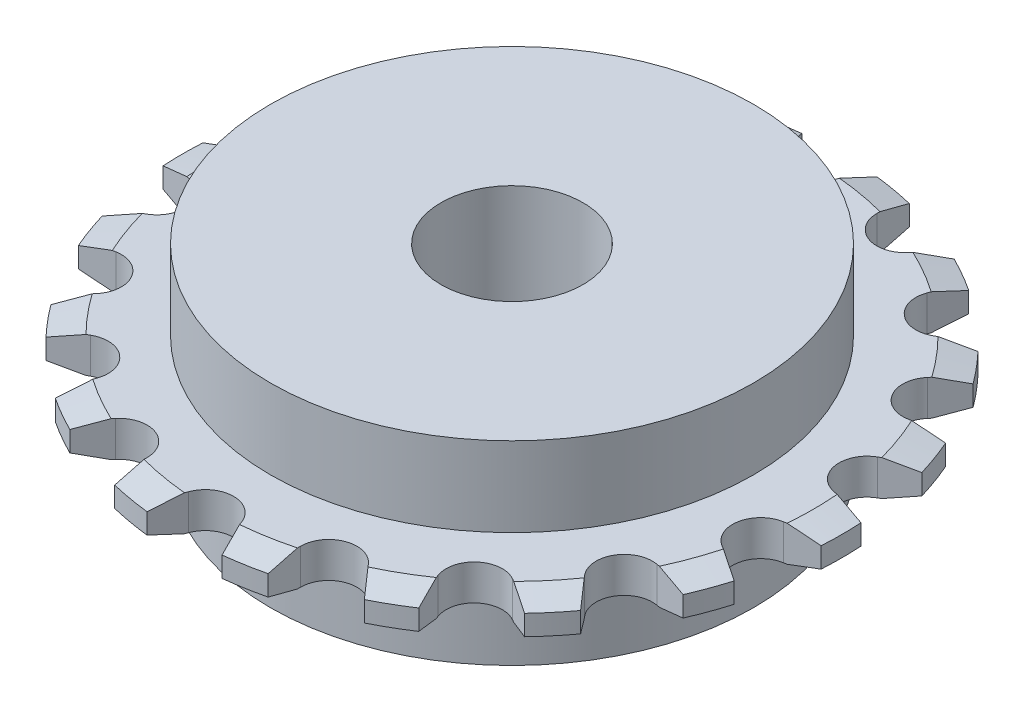
from build123d import *
from OCP.BRepFilletAPI import BRepFilletAPI_MakeChamfer

# Parameters (mm, degrees)
SKETCH1_R                = 29.468618182
SKETCH1_R_2              = 6.35
BOSS_EXTRUDE1_DEPTH      = 3.175
CHAMFER1_SIZE            = 2.54
CHAMFER1_SIZE2           = 0.680590949
CUT_EXTRUDE2_DEPTH       = 42.795688056
BOSS_EXTRUDE2_DEPTH      = 7.112
BOSS_EXTRUDE2_DEPTH_BACK = 10.287
SKETCH4_R                = 21.59
SKETCH4_R_2              = 6.35


with BuildPart() as part:
    # Sketch1 → Boss-Extrude1 (new body)
    with BuildSketch(Plane(origin=(0, 0, 0), x_dir=(1, 0, 0), z_dir=(0, 1, 0))):
        with Locations(Location((0, 0, 0), (0, 0, 270))):
            Circle(SKETCH1_R)
        with Locations(Location((0, 0, 0), (0, 0, 270))):
            Circle(SKETCH1_R_2, mode=Mode.SUBTRACT)
    extrude(amount=BOSS_EXTRUDE1_DEPTH)

    # Chamfer1: one chamfer whose edges measure the first distance from different faces: ONE call of the kernel's chamfer builder (chamfer() names one face for all edges)
    chamfer1_edges_1 = [part.edges().sort_by_distance(p)[0] for p in [
        (0, 0, -29.468618182),
    ]]
    chamfer1_side_1 = [part.faces().sort_by_distance(p)[0] for p in [
        (0, 0, -28.635119792),
    ]]
    chamfer1_edges_2 = [part.edges().sort_by_distance(p)[0] for p in [
        (0, 3.175, -29.468618182),
    ]]
    chamfer1_side_2 = [part.faces().sort_by_distance(p)[0] for p in [
        (0, 3.175, -28.635119792),
    ]]
    chamfer1 = BRepFilletAPI_MakeChamfer(part.part.solid().wrapped)
    for e in chamfer1_edges_1:
        chamfer1.Add(CHAMFER1_SIZE, CHAMFER1_SIZE2, e.wrapped, chamfer1_side_1[0].wrapped)  # the first distance lies on this face
    for e in chamfer1_edges_2:
        chamfer1.Add(CHAMFER1_SIZE, CHAMFER1_SIZE2, e.wrapped, chamfer1_side_2[0].wrapped)  # the first distance lies on this face
    add(Compound.cast(chamfer1.Shape()), mode=Mode.REPLACE)

    # Sketch3 → Cut-Extrude2 (cut, through all)
    with BuildSketch(Plane(origin=(0, 3.175, 0), x_dir=(1, 0, 0), z_dir=(0, 1, 0))):
        with BuildLine():
            Line((2.362951064, 26.551174329), (3.355071849, 29.277003782))
            ThreePointArc((3.355071849, 29.277003782), (0, 29.468618182), (-3.355071849, 29.277003782))
            Line((-3.355071849, 29.277003782), (-2.362951064, 26.551174329))
            ThreePointArc((-2.362951064, 26.551174329), (0, 24.896618182), (2.362951064, 26.551174329))
        make_face()
        with BuildLine():
            Line((6.860588771, 25.758119452), (6.860588771, 28.658886567))
            ThreePointArc((6.860588771, 28.658886567), (10.078861014, 27.69144305), (13.166061288, 26.363882258))
            Line((13.166061288, 26.363882258), (11.301484128, 24.141765729))
            ThreePointArc((11.301484128, 24.141765729), (8.515144919, 23.395168388), (6.860588771, 25.758119452))
        make_face()
        with BuildLine():
            Line((15.256640349, 21.85825522), (16.248761134, 24.584084672))
            ThreePointArc((16.248761134, 24.584084672), (18.942062642, 22.574271205), (21.389029426, 20.270887444))
            Line((21.389029426, 20.270887444), (18.876891414, 18.820503887))
            ThreePointArc((18.876891414, 18.820503887), (16.00323769, 19.071916011), (15.256640349, 21.85825522))
        make_face()
        with BuildLine():
            Line((21.812515937, 15.321962814), (23.677093097, 17.544079343))
            ThreePointArc((23.677093097, 17.544079343), (25.52057196, 14.734309091), (27.032164946, 11.732924438))
            Line((27.032164946, 11.732924438), (24.175467002, 11.229211515))
            ThreePointArc((24.175467002, 11.229211515), (21.561103814, 12.448309091), (21.812515937, 15.321962814))
        make_face()
        with BuildLine():
            Line((25.737480185, 6.937615565), (28.249618197, 8.387999123))
            ThreePointArc((28.249618197, 8.387999123), (29.020923656, 5.117171846), (29.414822422, 1.779797586))
            Line((29.414822422, 1.779797586), (26.558124477, 2.283510509))
            ThreePointArc((26.558124477, 2.283510509), (24.518382609, 4.323252377), (25.737480185, 6.937615565))
        make_face()
        with BuildLine():
            Line((26.558124477, -2.283510509), (29.414822422, -1.779797586))
            ThreePointArc((29.414822422, -1.779797586), (29.020923656, -5.117171846), (28.249618197, -8.387999123))
            Line((28.249618197, -8.387999123), (25.737480185, -6.937615565))
            ThreePointArc((25.737480185, -6.937615565), (24.518382609, -4.323252377), (26.558124477, -2.283510509))
        make_face()
        with BuildLine():
            Line((24.175467002, -11.229211515), (27.032164946, -11.732924438))
            ThreePointArc((27.032164946, -11.732924438), (25.52057196, -14.734309091), (23.677093097, -17.544079343))
            Line((23.677093097, -17.544079343), (21.812515937, -15.321962814))
            ThreePointArc((21.812515937, -15.321962814), (21.561103814, -12.448309091), (24.175467002, -11.229211515))
        make_face()
        with BuildLine():
            Line((18.876891414, -18.820503887), (21.389029426, -20.270887444))
            ThreePointArc((21.389029426, -20.270887444), (18.942062642, -22.574271205), (16.248761134, -24.584084672))
            Line((16.248761134, -24.584084672), (15.256640349, -21.85825522))
            ThreePointArc((15.256640349, -21.85825522), (16.00323769, -19.071916011), (18.876891414, -18.820503887))
        make_face()
        with BuildLine():
            Line((11.301484128, -24.141765729), (13.166061288, -26.363882258))
            ThreePointArc((13.166061288, -26.363882258), (10.078861014, -27.69144305), (6.860588771, -28.658886567))
            Line((6.860588771, -28.658886567), (6.860588771, -25.758119452))
            ThreePointArc((6.860588771, -25.758119452), (8.515144919, -23.395168388), (11.301484128, -24.141765729))
        make_face()
        with BuildLine():
            Line((2.362951064, -26.551174329), (3.355071849, -29.277003782))
            ThreePointArc((3.355071849, -29.277003782), (0, -29.468618182), (-3.355071849, -29.277003782))
            Line((-3.355071849, -29.277003782), (-2.362951064, -26.551174329))
            ThreePointArc((-2.362951064, -26.551174329), (0, -24.896618182), (2.362951064, -26.551174329))
        make_face()
        with BuildLine():
            Line((-6.860588771, -25.758119452), (-6.860588771, -28.658886567))
            ThreePointArc((-6.860588771, -28.658886567), (-10.078861014, -27.69144305), (-13.166061288, -26.363882258))
            Line((-13.166061288, -26.363882258), (-11.301484128, -24.141765729))
            ThreePointArc((-11.301484128, -24.141765729), (-8.515144919, -23.395168388), (-6.860588771, -25.758119452))
        make_face()
        with BuildLine():
            Line((-15.256640349, -21.85825522), (-16.248761134, -24.584084672))
            ThreePointArc((-16.248761134, -24.584084672), (-18.942062642, -22.574271205), (-21.389029426, -20.270887444))
            Line((-21.389029426, -20.270887444), (-18.876891414, -18.820503887))
            ThreePointArc((-18.876891414, -18.820503887), (-16.00323769, -19.071916011), (-15.256640349, -21.85825522))
        make_face()
        with BuildLine():
            Line((-21.812515937, -15.321962814), (-23.677093097, -17.544079343))
            ThreePointArc((-23.677093097, -17.544079343), (-25.52057196, -14.734309091), (-27.032164946, -11.732924438))
            Line((-27.032164946, -11.732924438), (-24.175467002, -11.229211515))
            ThreePointArc((-24.175467002, -11.229211515), (-21.561103814, -12.448309091), (-21.812515937, -15.321962814))
        make_face()
        with BuildLine():
            Line((-25.737480185, -6.937615565), (-28.249618197, -8.387999123))
            ThreePointArc((-28.249618197, -8.387999123), (-29.020923656, -5.117171846), (-29.414822422, -1.779797586))
            Line((-29.414822422, -1.779797586), (-26.558124477, -2.283510509))
            ThreePointArc((-26.558124477, -2.283510509), (-24.518382609, -4.323252377), (-25.737480185, -6.937615565))
        make_face()
        with BuildLine():
            Line((-26.558124477, 2.283510509), (-29.414822422, 1.779797586))
            ThreePointArc((-29.414822422, 1.779797586), (-29.020923656, 5.117171846), (-28.249618197, 8.387999123))
            Line((-28.249618197, 8.387999123), (-25.737480185, 6.937615565))
            ThreePointArc((-25.737480185, 6.937615565), (-24.518382609, 4.323252377), (-26.558124477, 2.283510509))
        make_face()
        with BuildLine():
            Line((-24.175467002, 11.229211515), (-27.032164946, 11.732924438))
            ThreePointArc((-27.032164946, 11.732924438), (-25.52057196, 14.734309091), (-23.677093097, 17.544079343))
            Line((-23.677093097, 17.544079343), (-21.812515937, 15.321962814))
            ThreePointArc((-21.812515937, 15.321962814), (-21.561103814, 12.448309091), (-24.175467002, 11.229211515))
        make_face()
        with BuildLine():
            Line((-18.876891414, 18.820503887), (-21.389029426, 20.270887444))
            ThreePointArc((-21.389029426, 20.270887444), (-18.942062642, 22.574271205), (-16.248761134, 24.584084672))
            Line((-16.248761134, 24.584084672), (-15.256640349, 21.85825522))
            ThreePointArc((-15.256640349, 21.85825522), (-16.00323769, 19.071916011), (-18.876891414, 18.820503887))
        make_face()
        with BuildLine():
            Line((-11.301484128, 24.141765729), (-13.166061288, 26.363882258))
            ThreePointArc((-13.166061288, 26.363882258), (-10.078861014, 27.69144305), (-6.860588771, 28.658886567))
            Line((-6.860588771, 28.658886567), (-6.860588771, 25.758119452))
            ThreePointArc((-6.860588771, 25.758119452), (-8.515144919, 23.395168388), (-11.301484128, 24.141765729))
        make_face()
    extrude(amount=-CUT_EXTRUDE2_DEPTH, mode=Mode.SUBTRACT)

    # Sketch4 → Boss-Extrude2 (add, two sides: drawn at the far end of the back side and taken through both)
    with BuildSketch(Plane(origin=(0, 3.175, 0), x_dir=(1, 0, 0), z_dir=(0, 1, 0)).offset(-BOSS_EXTRUDE2_DEPTH_BACK)):
        with Locations(Location((0, 0, 0), (0, 0, 270))):
            Circle(SKETCH4_R)
        with Locations(Location((0, 0, 0), (0, 0, 270))):
            Circle(SKETCH4_R_2, mode=Mode.SUBTRACT)
    extrude(amount=BOSS_EXTRUDE2_DEPTH + BOSS_EXTRUDE2_DEPTH_BACK)


solid = part.part
